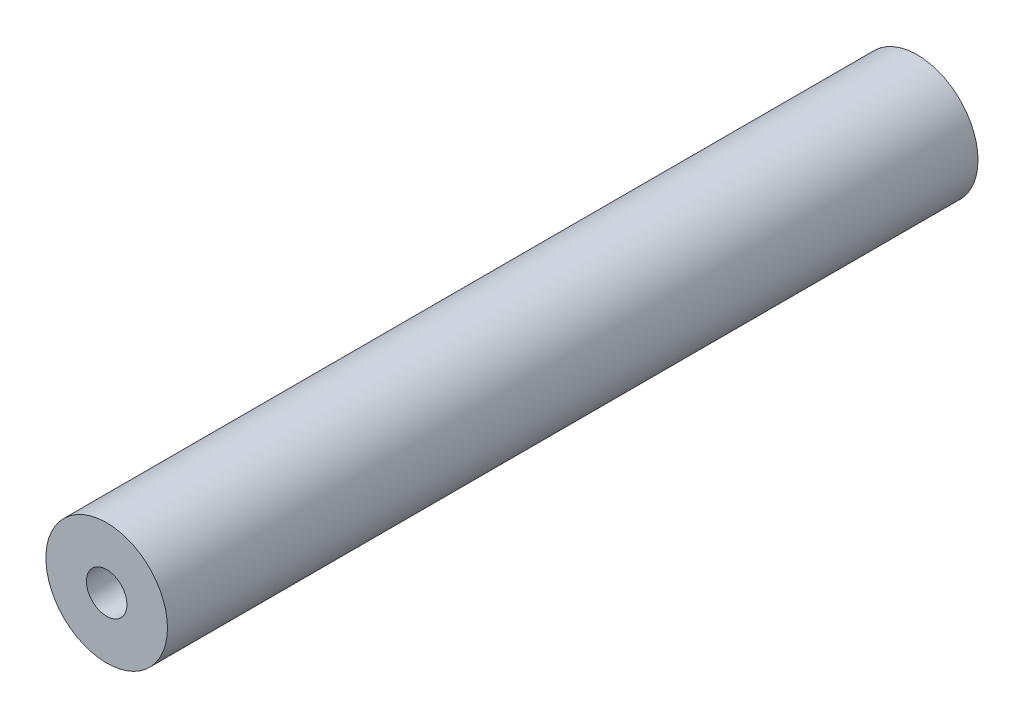
from build123d import *

# Parameters (mm, degrees)
SKETCH1_R           = 4.7625
BOSS_EXTRUDE2_DEPTH = 63.5
SKETCH5_R           = 1.5875
CUT_EXTRUDE1_DEPTH  = 12.7
CUT_EXTRUDE2_START  = 12.7
SKETCH6_R           = 1.5875
CUT_EXTRUDE2_DEPTH  = 12.7


with BuildPart() as part:
    # Sketch1 → Boss-Extrude2 (new body)
    with BuildSketch(Plane.XY):
        Circle(SKETCH1_R)
    extrude(amount=BOSS_EXTRUDE2_DEPTH)

    # Sketch5 → Cut-Extrude1 (cut)
    with BuildSketch(Plane.XY):
        Circle(SKETCH5_R)
    extrude(amount=CUT_EXTRUDE1_DEPTH, mode=Mode.SUBTRACT)

    # Sketch6 → Cut-Extrude2 (cut)
    with BuildSketch(Plane(origin=(0, 0, 63.5), x_dir=(-1, 0, 0), z_dir=(0, 0, -1)).offset(CUT_EXTRUDE2_START)):
        with Locations(Location((0, 0, 0), (0, 0, 180))):
            Circle(SKETCH6_R)
    extrude(amount=-CUT_EXTRUDE2_DEPTH, mode=Mode.SUBTRACT)


solid = part.part
